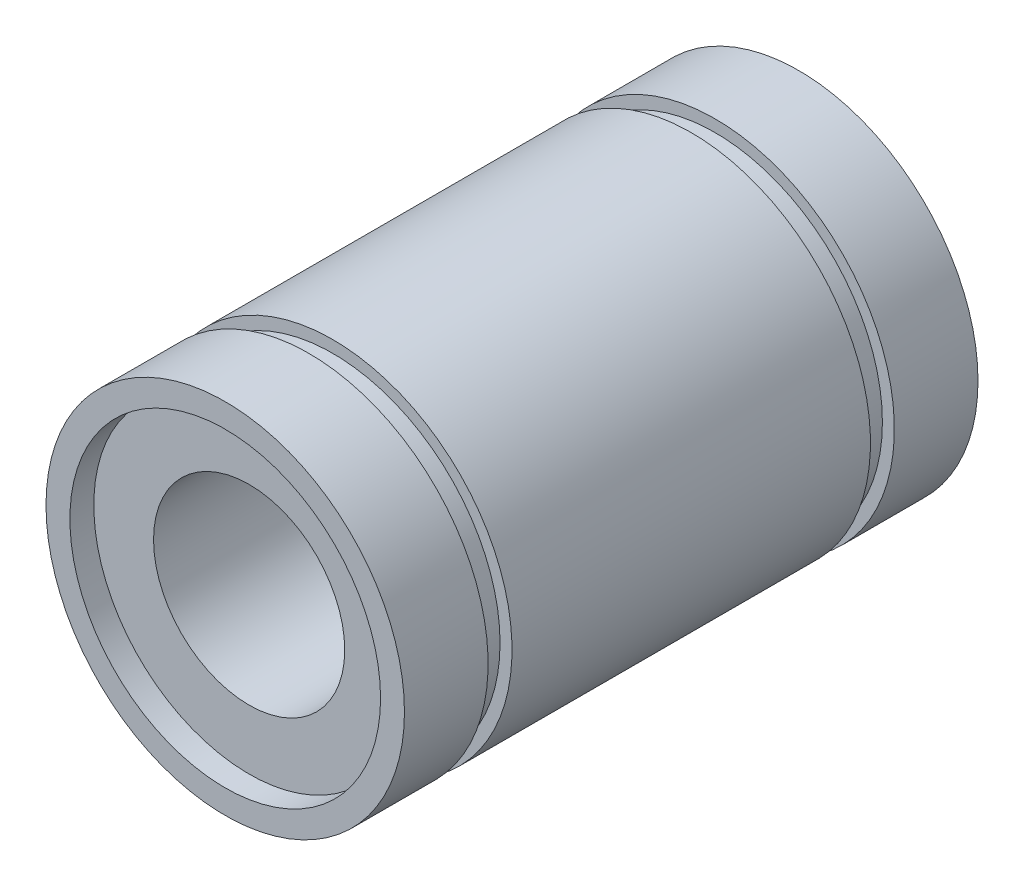
from build123d import *

# Parameters (mm, degrees)
SKETCH1_R           = 7.5
SKETCH1_R_2         = 6.5
BOSS_EXTRUDE1_DEPTH = 12
SKETCH2_R           = 6.5
SKETCH2_R_2         = 4
BOSS_EXTRUDE2_DEPTH = 11
SKETCH3_W           = 0.5
SKETCH3_H           = 1


with BuildPart() as part:
    # Sketch1 → Boss-Extrude1 (new, symmetric)
    with BuildSketch(Plane.XY):
        Circle(SKETCH1_R)
        Circle(SKETCH1_R_2, mode=Mode.SUBTRACT)
    extrude(amount=BOSS_EXTRUDE1_DEPTH, both=True)

    # Sketch3 → Cut-Revolve1 (revolve, cut)
    with BuildSketch(Plane(origin=(0, 0, 0), x_dir=(1, 0, 0), z_dir=(0, 1, 0)), mode=Mode.PRIVATE) as cut_revolve1_sk:
        with Locations((7.25, 8)):
            Rectangle(SKETCH3_W, SKETCH3_H)
        with Locations((7.25, -8)):
            Rectangle(SKETCH3_W, SKETCH3_H)
    revolve(cut_revolve1_sk.sketch.rotate(Axis((0, 0, -12), (0, 0, 1)), 180), axis=Axis((0, 0, -12), (0, 0, 1)), mode=Mode.SUBTRACT)


with BuildPart() as body_2:
    # Sketch2 → Boss-Extrude2 (new, symmetric)
    with BuildSketch(Plane.XY):
        Circle(SKETCH2_R)
        Circle(SKETCH2_R_2, mode=Mode.SUBTRACT)
    extrude(amount=BOSS_EXTRUDE2_DEPTH, both=True)


solid = Compound([part.part, body_2.part])
